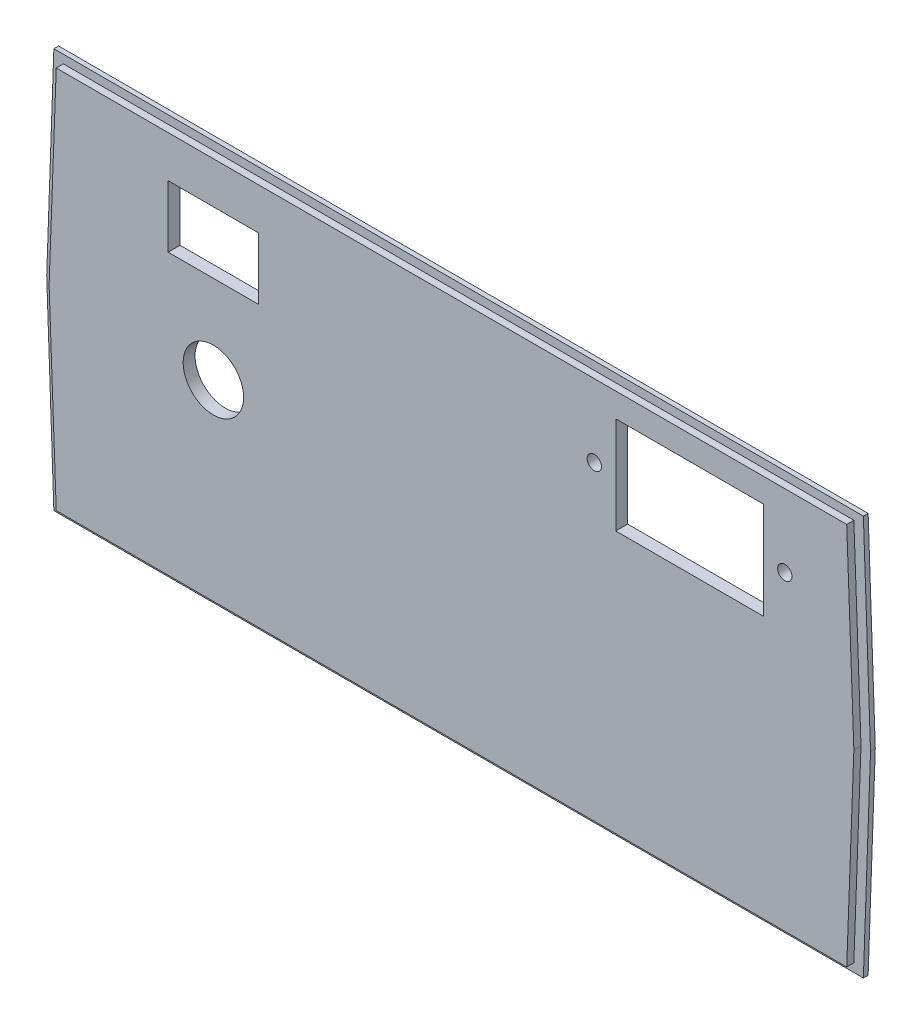
from build123d import *

# Parameters (mm, degrees)
BOSS_EXTRUDE1_DEPTH = 1
BOSS_EXTRUDE2_DEPTH = 1.5
CUT_EXTRUDE1_REACH  = 98.19
SKETCH3_R           = 1.5
SKETCH3_R_2         = 6.35
SKETCH3_W           = 31
SKETCH3_H           = 20.4
SKETCH3_W_2         = 19
SKETCH3_H_2         = 13


with BuildPart() as part:
    # Sketch1 → Boss-Extrude1 (new body)
    with BuildSketch(Plane.XY):
        Polygon((-85, 42), (85, 42), (86.5, 0), (85, -42), (-85, -42), (-86.5, 0), align=None)
    extrude(amount=BOSS_EXTRUDE1_DEPTH)

    # Sketch2 → Boss-Extrude2 (add)
    with BuildSketch(Plane.XY.offset(1)):
        Polygon((-83, 40.25), (83, 40.25), (84.5, 0), (83, -40.25), (-83, -40.25), (-84.5, 0), align=None)
    extrude(amount=BOSS_EXTRUDE2_DEPTH)

    # Sketch3 → Cut-Extrude1 (cut, up to next)
    with BuildSketch(Plane(origin=(0, 0, 0), x_dir=(-1, 0, 0), z_dir=(0, 0, -1)), mode=Mode.PRIVATE) as cut_extrude1_sk1:
        with Locations((-70, 25)):
            Circle(SKETCH3_R)
    cut_extrude1_tool1 = extrude(cut_extrude1_sk1.sketch, amount=-CUT_EXTRUDE1_REACH, mode=Mode.PRIVATE) & part.part
    # Sketch3 → Cut-Extrude1 (cut, up to next)
    with BuildSketch(Plane(origin=(0, 0, 0), x_dir=(-1, 0, 0), z_dir=(0, 0, -1)), mode=Mode.PRIVATE) as cut_extrude1_sk2:
        with Locations((-30, 25)):
            Circle(SKETCH3_R)
    cut_extrude1_tool2 = extrude(cut_extrude1_sk2.sketch, amount=-CUT_EXTRUDE1_REACH, mode=Mode.PRIVATE) & part.part
    # Sketch3 → Cut-Extrude1 (cut, up to next)
    with BuildSketch(Plane(origin=(0, 0, 0), x_dir=(-1, 0, 0), z_dir=(0, 0, -1)), mode=Mode.PRIVATE) as cut_extrude1_sk3:
        with Locations((50, 0)):
            Circle(SKETCH3_R_2)
    cut_extrude1_tool3 = extrude(cut_extrude1_sk3.sketch, amount=-CUT_EXTRUDE1_REACH, mode=Mode.PRIVATE) & part.part
    # Sketch3 → Cut-Extrude1 (cut, up to next)
    with BuildSketch(Plane(origin=(0, 0, 0), x_dir=(-1, 0, 0), z_dir=(0, 0, -1)), mode=Mode.PRIVATE) as cut_extrude1_sk4:
        with Locations((-50, 25)):
            Rectangle(SKETCH3_W, SKETCH3_H)
    cut_extrude1_tool4 = extrude(cut_extrude1_sk4.sketch, amount=-CUT_EXTRUDE1_REACH, mode=Mode.PRIVATE) & part.part
    # Sketch3 → Cut-Extrude1 (cut, up to next)
    with BuildSketch(Plane(origin=(0, 0, 0), x_dir=(-1, 0, 0), z_dir=(0, 0, -1)), mode=Mode.PRIVATE) as cut_extrude1_sk5:
        with Locations((50, 25)):
            Rectangle(SKETCH3_W_2, SKETCH3_H_2)
    cut_extrude1_tool5 = extrude(cut_extrude1_sk5.sketch, amount=-CUT_EXTRUDE1_REACH, mode=Mode.PRIVATE) & part.part
    add(cut_extrude1_tool1.solids().sort_by_distance((70, 25, 0))[0], mode=Mode.SUBTRACT)
    add(cut_extrude1_tool2.solids().sort_by_distance((30, 25, 0))[0], mode=Mode.SUBTRACT)
    add(cut_extrude1_tool3.solids().sort_by_distance((-50, 0, 0))[0], mode=Mode.SUBTRACT)
    add(cut_extrude1_tool4.solids().sort_by_distance((50, 25, 0))[0], mode=Mode.SUBTRACT)
    add(cut_extrude1_tool5.solids().sort_by_distance((-50, 25, 0))[0], mode=Mode.SUBTRACT)


solid = part.part
